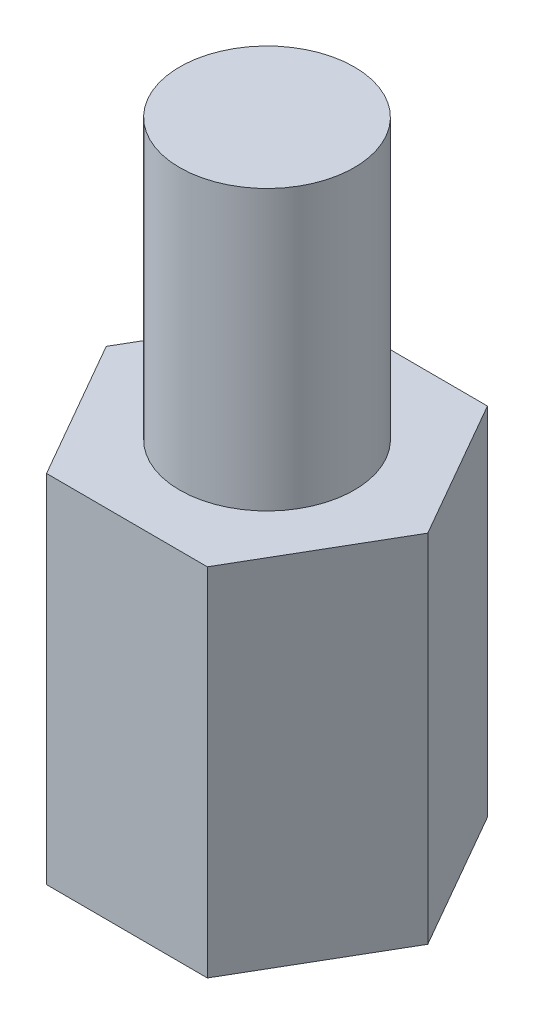
from build123d import *

# Parameters (mm, degrees)
BOSS_EXTRUDE1_DEPTH = 5.1
SKETCH2_R           = 1.25
BOSS_EXTRUDE2_DEPTH = 4
SKETCH3_R           = 1.27
CUT_EXTRUDE1_DEPTH  = 2


with BuildPart() as part:
    # Sketch1 → Boss-Extrude1 (new body)
    with BuildSketch(Plane(origin=(0, 0, 0), x_dir=(1, 0, 0), z_dir=(0, 1, 0))):
        Polygon((1.160641483, 1.996558209), (-1.148749388, 2.003424113), (-2.30939087, 0.006865904), (-1.160641483, -1.996558209), (1.148749388, -2.003424113), (2.30939087, -0.006865904), align=None)
    extrude(amount=BOSS_EXTRUDE1_DEPTH)

    # Sketch2 → Boss-Extrude2 (add)
    with BuildSketch(Plane(origin=(0, 5.1, 0), x_dir=(1, 0, 0), z_dir=(0, 1, 0))):
        with Locations(Location((0, 0, 0), (0, 0, 270))):
            Circle(SKETCH2_R)
    extrude(amount=BOSS_EXTRUDE2_DEPTH)

    # Sketch3 → Cut-Extrude1 (cut)
    with BuildSketch(Plane.XZ):
        with Locations(Location((0, 0, 0), (0, 0, 270))):
            Circle(SKETCH3_R)
    extrude(amount=-CUT_EXTRUDE1_DEPTH, mode=Mode.SUBTRACT)


solid = part.part
